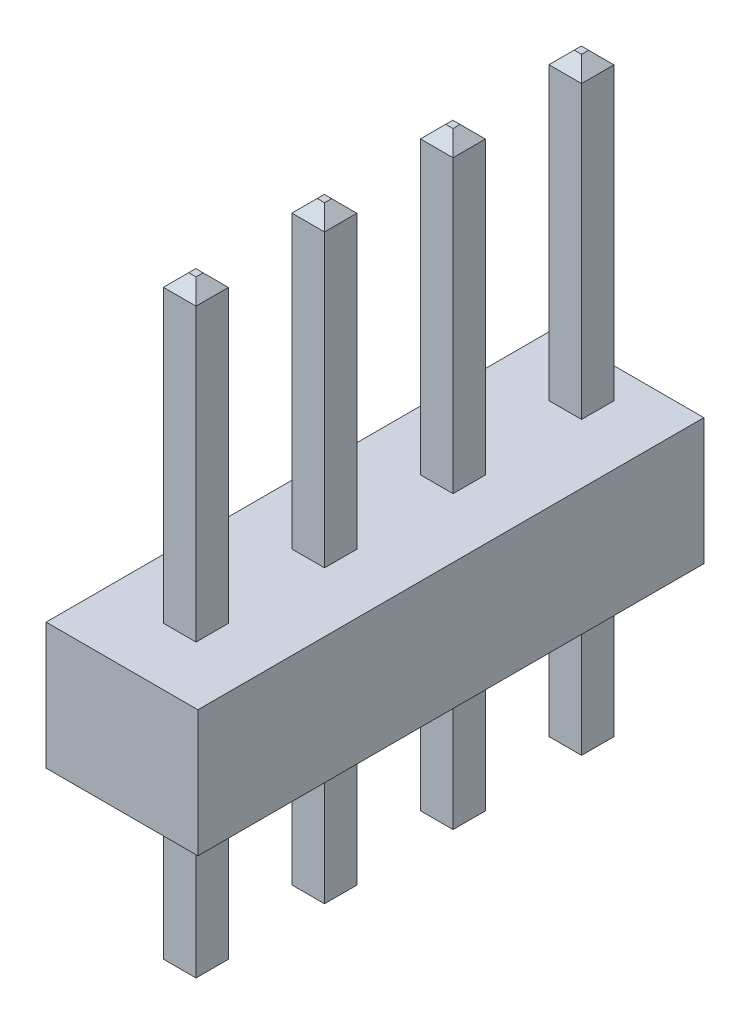
from build123d import *

# Parameters (mm, degrees)
SKETCH1_W       = 3
SKETCH1_H       = 2.5
EXTRUDE1_DEPTH  = 5
SKETCH2_W       = 0.645
SKETCH2_H       = 6
SKETCH2_H_2     = 3.5
EXTRUDE2_DEPTH  = 0.64
LPATTERN1_COUNT = 4
LPATTERN1_PITCH = 2.54
CHAMFER1_SIZE   = 0.25


with BuildPart() as part:
    # Sketch1 → Extrude1 (new, symmetric)
    with BuildSketch(Plane.XY):
        Rectangle(SKETCH1_W, SKETCH1_H)
    extrude(amount=EXTRUDE1_DEPTH, both=True)

    # Sketch2 → Extrude2 (add)
    with BuildSketch(Plane.XY.offset(3.86)):
        with Locations((0, 4.25)):
            Rectangle(SKETCH2_W, SKETCH2_H)
        with Locations((0, -3)):
            Rectangle(SKETCH2_W, SKETCH2_H_2)
    extrude2 = extrude(amount=-EXTRUDE2_DEPTH)

    # LPattern1: Extrude2 ×4
    with Locations(*[(0, 0, -i * LPATTERN1_PITCH) for i in range(1, LPATTERN1_COUNT)]):
        add(extrude2)

    # Chamfer1
    chamfer1_edges = [part.edges().sort_by_distance(p)[0] for p in [
        (0.3225, 7.25, 3.54),
        (0, 7.25, 3.22),
        (-0.3225, 7.25, 3.54),
        (0, 7.25, 3.86),
        (0, -4.75, 3.22),
        (0.3225, -4.75, 3.54),
        (-0.3225, -4.75, 3.54),
        (0, -4.75, 3.86),
        (0.3225, 7.25, 1),
        (0, 7.25, 0.68),
        (-0.3225, 7.25, 1),
        (0, 7.25, 1.32),
        (0, -4.75, 0.68),
        (0.3225, -4.75, 1),
        (-0.3225, -4.75, 1),
        (0, -4.75, 1.32),
        (0.3225, 7.25, -1.54),
        (0, 7.25, -1.86),
        (-0.3225, 7.25, -1.54),
        (0, 7.25, -1.22),
        (0, -4.75, -1.86),
        (0.3225, -4.75, -1.54),
        (-0.3225, -4.75, -1.54),
        (0, -4.75, -1.22),
        (0.3225, 7.25, -4.08),
        (0, 7.25, -4.4),
        (-0.3225, 7.25, -4.08),
        (0, 7.25, -3.76),
        (0, -4.75, -4.4),
        (0.3225, -4.75, -4.08),
        (-0.3225, -4.75, -4.08),
        (0, -4.75, -3.76),
    ]]
    chamfer(chamfer1_edges, length=CHAMFER1_SIZE)


solid = part.part
